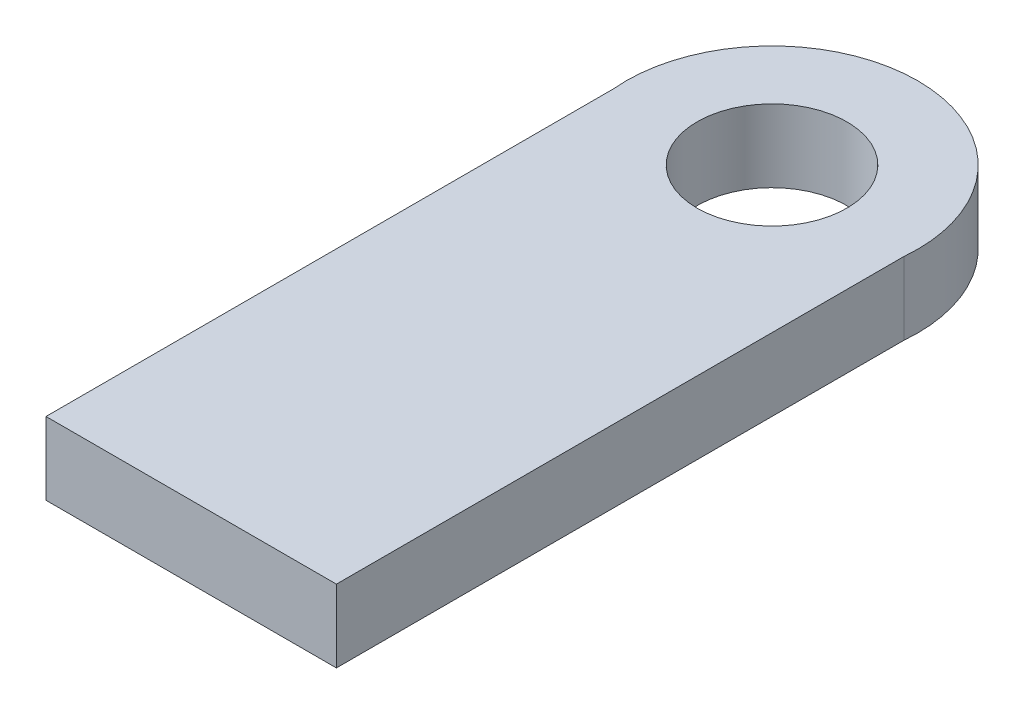
from build123d import *

# Parameters (mm, degrees)
SKETCH1_R           = 6.54812
BOSS_EXTRUDE3_DEPTH = 6.35


with BuildPart() as part:
    # Sketch1 → Boss-Extrude3 (new body)
    with BuildSketch(Plane(origin=(0, 0, 0), x_dir=(1, 0, 0), z_dir=(0, 1, 0))):
        with BuildLine():
            Line((-19.473738898, 31.474503951), (-19.473738898, -18.151447985))
            Line((-19.473738898, -18.151447985), (5.926261102, -18.151447985))
            Line((5.926261102, -18.151447985), (5.926261102, 31.474503951))
            ThreePointArc((5.926261102, 31.474503951), (-6.773738898, 45.402703843), (-19.473738898, 31.474503951))
        make_face()
        with Locations((-6.773738898, 32.648552015)):
            Circle(SKETCH1_R, mode=Mode.SUBTRACT)
    extrude(amount=-BOSS_EXTRUDE3_DEPTH)


solid = part.part
